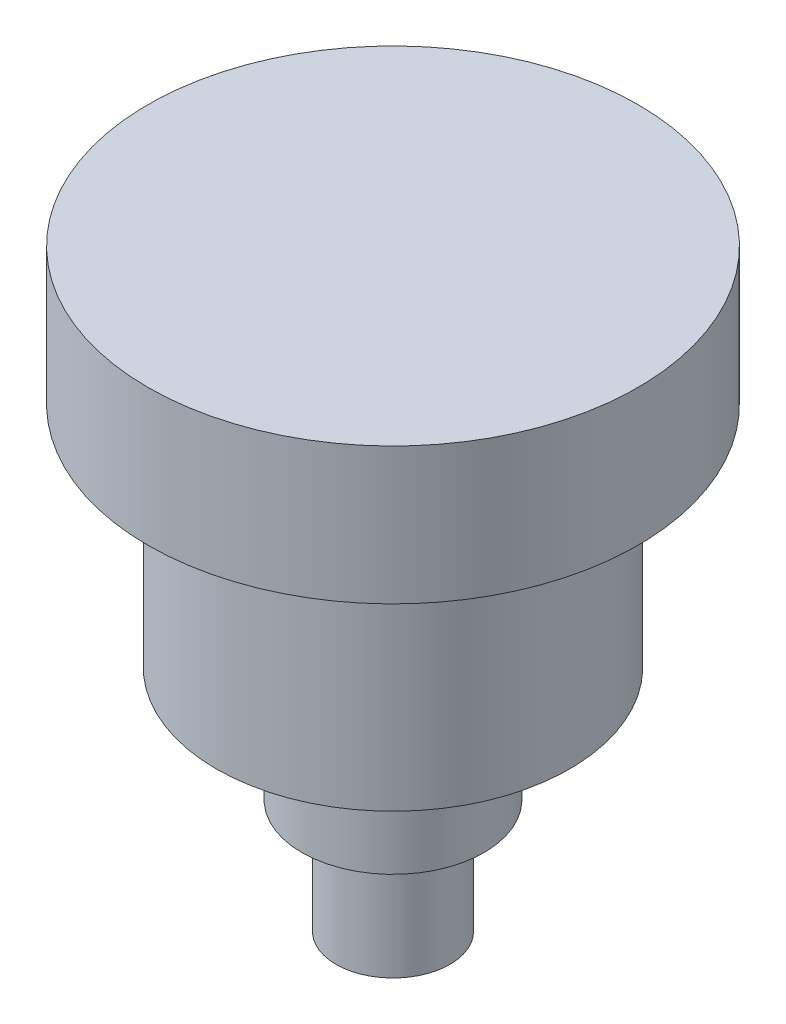
from build123d import *


with BuildPart() as part:
    # Sketch1 → Revolve1 (revolve)
    with BuildSketch(Plane.XY, mode=Mode.PRIVATE) as revolve1_sk:
        Polygon((0, 0), (2.5, 0), (2.5, 5), (4, 5), (4, 10), (5, 10), (5, 10.05), (7.75, 10.05), (7.75, 20.05), (10.75, 20.05), (10.75, 26.05), (0, 26.05), align=None)
    revolve(revolve1_sk.sketch.rotate(Axis((0, 35.15, 0), (0, -1, 0)), 90), axis=Axis((0, 35.15, 0), (0, -1, 0)))


solid = part.part
